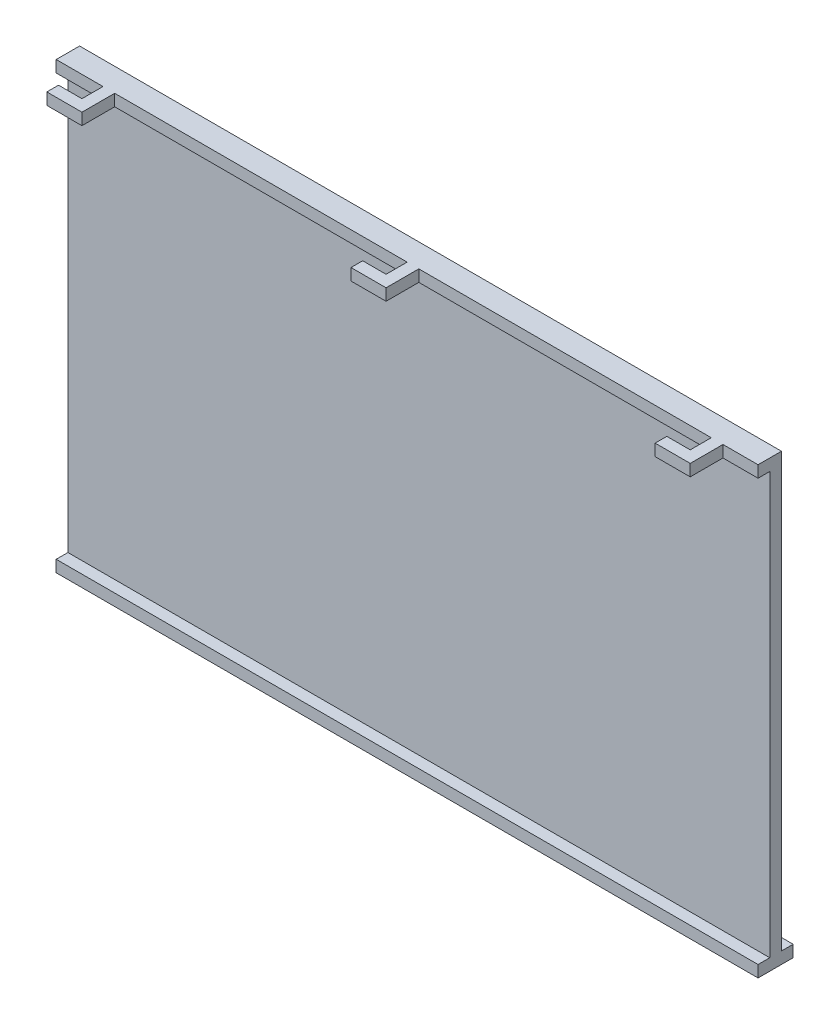
from build123d import *

# Parameters (mm, degrees)
SKETCH1_W           = 5
SKETCH1_H           = 190
SKETCH1_H_2         = 5
BOSS_EXTRUDE1_DEPTH = 150
BOSS_EXTRUDE2_DEPTH = 5


with BuildPart() as part:
    # Sketch1 → Boss-Extrude1 (new, symmetric)
    with BuildSketch(Plane(origin=(0, 0, 0), x_dir=(0, 0, -1), z_dir=(1, 0, 0))):
        with Locations((0, 95)):
            Rectangle(SKETCH1_W, SKETCH1_H)
        with Locations((-5, 187.5)):
            Rectangle(SKETCH1_W, SKETCH1_H_2)
        with Locations((5, 2.5)):
            Rectangle(SKETCH1_W, SKETCH1_H_2)
        with Locations((-5, 2.5)):
            Rectangle(SKETCH1_W, SKETCH1_H_2)
    extrude(amount=BOSS_EXTRUDE1_DEPTH, both=True)

    # Sketch2 → Boss-Extrude2 (add)
    with BuildSketch(Plane(origin=(0, 190, 0), x_dir=(1, 0, 0), z_dir=(0, 1, 0))):
        Polygon((135, -7.5), (135, -21.5), (120, -21.5), (120, -16.5), (130, -16.5), (130, -7.5), align=None)
        Polygon((0, -7.5), (5, -7.5), (5, -21.5), (-10, -21.5), (-10, -16.5), (0, -16.5), align=None)
        Polygon((-130, -7.5), (-125, -7.5), (-125, -21.5), (-140, -21.5), (-140, -16.5), (-130, -16.5), align=None)
    extrude(amount=-BOSS_EXTRUDE2_DEPTH)


solid = part.part
